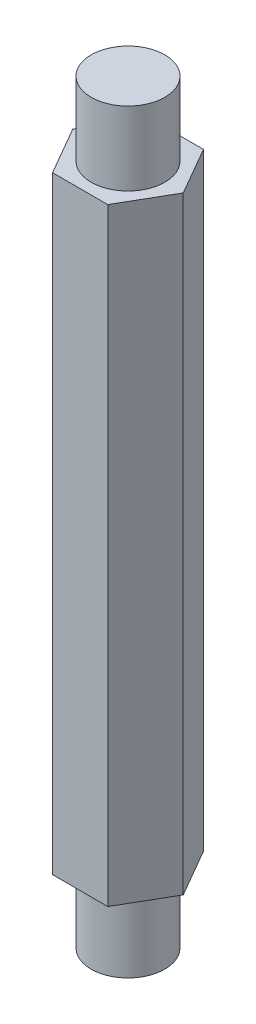
from build123d import *

# Parameters (mm, degrees)
SKETCH_1_R      = 1
EXTRUDE_1_DEPTH = 2
EXTRUDE_2_DEPTH = 16.52
SKETCH_3_R      = 1
EXTRUDE_3_DEPTH = 2


with BuildPart() as part:
    # 草图1 → 凸台-拉伸1 (new body)
    with BuildSketch(Plane(origin=(0, 0, 0), x_dir=(1, 0, 0), z_dir=(0, 1, 0))):
        with Locations(Location((0, 0, 0), (0, 0, 270))):
            Circle(SKETCH_1_R)
    extrude(amount=EXTRUDE_1_DEPTH)

    # 草图2 → 凸台-拉伸2 (add)
    with BuildSketch(Plane(origin=(0, 2, 0), x_dir=(1, 0, 0), z_dir=(0, 1, 0))):
        Polygon((1.5011107, 0), (0.75055535, 1.3), (-0.75055535, 1.3), (-1.5011107, 0), (-0.75055535, -1.3), (0.75055535, -1.3), align=None)
    extrude(amount=EXTRUDE_2_DEPTH)

    # 草图3 → 凸台-拉伸3 (add)
    with BuildSketch(Plane(origin=(0, 18.52, 0), x_dir=(1, 0, 0), z_dir=(0, 1, 0))):
        with Locations(Location((0, 0, 0), (0, 0, 270))):
            Circle(SKETCH_3_R)
    extrude(amount=EXTRUDE_3_DEPTH)


solid = part.part
